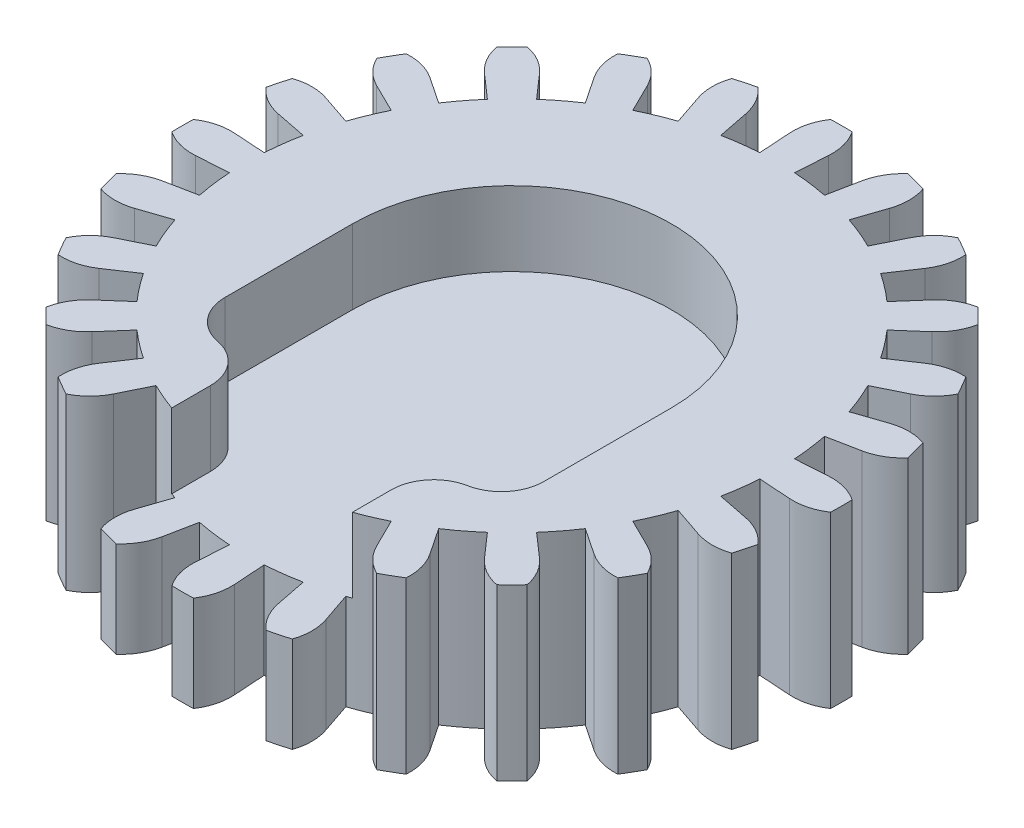
from build123d import *

# Parameters (mm, degrees)
BOSS_EXTRUDE3_DEPTH = 8
CIRPATTERN1_COUNT   = 24
CUT_EXTRUDE1_DEPTH  = 3.5
FILLET3_R           = 2
FILLET4_R           = 2
CUT_EXTRUDE2_DEPTH  = 3.5


with BuildPart() as part:
    # Sketch10 → Boss-Extrude3 (new body)
    with BuildSketch(Plane(origin=(0, 0, 0), x_dir=(1, 0, 0), z_dir=(0, 1, 0))):
        with BuildLine():
            ThreePointArc((15.491701106, 0.507145784), (15.5, 0), (15.491701106, -0.507145784))
            ThreePointArc((15.491701106, -0.507145784), (14.76463394, -0.837193229), (13.970024925, -0.915643809))
            Line((13.970024925, -0.915643809), (12.47323654, -0.817539115))
            ThreePointArc((12.47323654, -0.817539115), (12.439809083, -1.225214254), (12.393060767, -1.631577403))
            Line((12.393060767, -1.631577403), (0, 0))
            Line((0, 0), (12.393060767, 1.631577403))
            ThreePointArc((12.393060767, 1.631577403), (12.439809083, 1.225214254), (12.47323654, 0.817539115))
            Line((12.47323654, 0.817539115), (13.970024925, 0.915643809))
            ThreePointArc((13.970024925, 0.915643809), (14.76463394, 0.837193229), (15.491701106, 0.507145784))
        make_face()
    boss_extrude3 = extrude(amount=BOSS_EXTRUDE3_DEPTH)

    # CirPattern1: Boss-Extrude3 ×24 about axis
    cirpattern1_axis = Axis((0, 0, 0), (0, 1, 0))
    for i in range(1, CIRPATTERN1_COUNT):
        add(boss_extrude3.rotate(cirpattern1_axis, i * 360 / CIRPATTERN1_COUNT))

    # Sketch11 → Cut-Extrude1 (cut)
    with BuildSketch(Plane(origin=(0, 8, 0), x_dir=(1, 0, 0), z_dir=(0, 1, 0))):
        with BuildLine():
            Line((-7.5, 0), (-7.5, -8))
            Line((-7.5, -8), (-4.25, -8))
            Line((-4.25, -8), (-4.25, -23))
            Line((-4.25, -23), (4.25, -23))
            Line((4.25, -23), (4.25, -8))
            Line((4.25, -8), (7.5, -8))
            Line((7.5, -8), (7.5, 0))
            ThreePointArc((7.5, 0), (0, 7.5), (-7.5, 0))
        make_face()
    extrude(amount=-CUT_EXTRUDE1_DEPTH, mode=Mode.SUBTRACT)

    # Fillet3
    fillet3_edges = [part.edges().sort_by_distance(p)[0] for p in [
        (7.5, 6.25, 8),
        (-7.5, 6.25, 8),
    ]]
    fillet(fillet3_edges, radius=FILLET3_R)

    # Fillet4
    fillet4_edges = [part.edges().sort_by_distance(p)[0] for p in [
        (4.25, 6.25, 8),
        (-4.25, 6.25, 8),
    ]]
    fillet(fillet4_edges, radius=FILLET4_R)

    # Sketch12 → Cut-Extrude2 (cut)
    with BuildSketch(Plane(origin=(0, 8, 0), x_dir=(1, 0, 0), z_dir=(0, 1, 0))):
        Polygon((-4.25, -11.755317946), (4.25, -11.755317946), (5.704763156, -11.755317946), (5.704763156, -15.755317946), (-5.295236844, -15.755317946), (-5.295236844, -11.755317946), align=None)
    extrude(amount=-CUT_EXTRUDE2_DEPTH, mode=Mode.SUBTRACT)


solid = part.part
